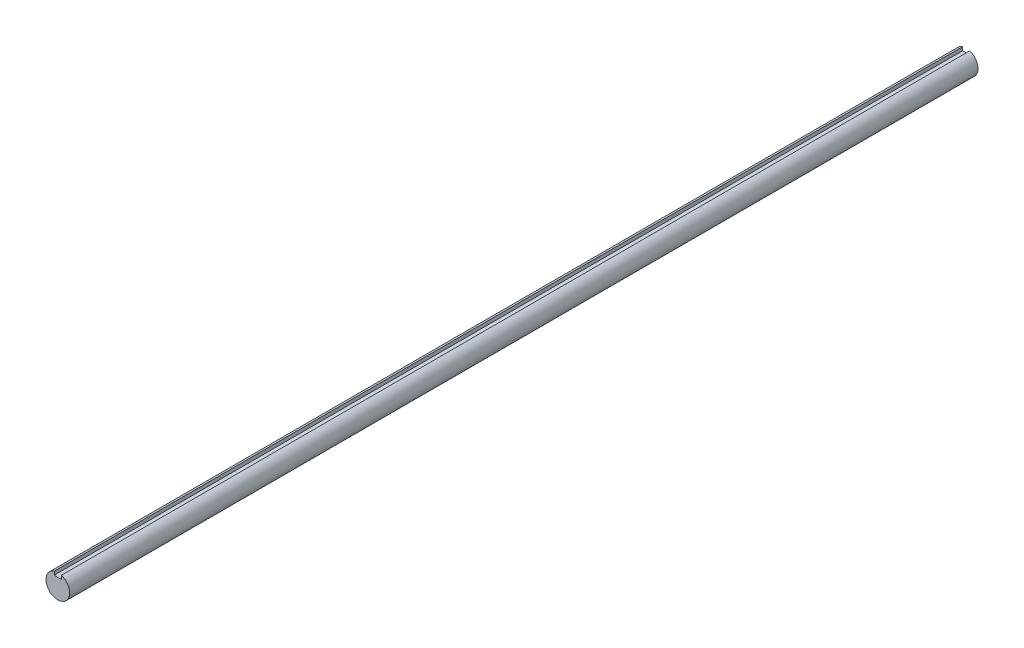
from build123d import *

# Parameters (mm, degrees)
BOSS_EXTRUDE1_DEPTH      = 152.4
BOSS_EXTRUDE1_DEPTH_BACK = 152.4


with BuildPart() as part:
    # Sketch3 → Boss-Extrude1 (new, two sides: drawn at the far end of the back side and taken through both)
    with BuildSketch(Plane.XY.offset(-BOSS_EXTRUDE1_DEPTH_BACK)):
        with BuildLine():
            Line((-1.1938, 2.591146251), (-1.1938, 3.784946251))
            ThreePointArc((-1.1938, 3.784946251), (0, -3.96875), (1.1938, 3.784946251))
            Line((1.1938, 3.784946251), (1.1938, 2.591146251))
            Line((1.1938, 2.591146251), (-1.1938, 2.591146251))
        make_face()
    extrude(amount=BOSS_EXTRUDE1_DEPTH + BOSS_EXTRUDE1_DEPTH_BACK)


solid = part.part
